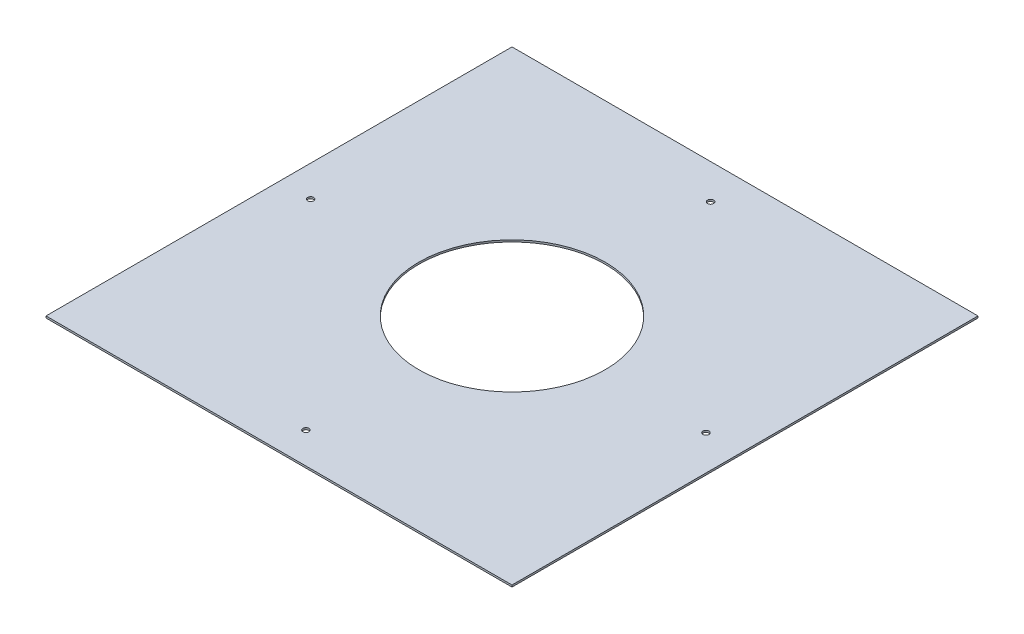
from build123d import *

# Parameters (mm, degrees)
SKETCH1_W           = 500
SKETCH1_H           = 500
SKETCH1_R           = 100
BOSS_EXTRUDE1_DEPTH = 2
SKETCH_1_R          = 3.25
CUT_EXTRUDE_1_DEPTH = 10


with BuildPart() as part:
    # Sketch1 → Boss-Extrude1 (new body)
    with BuildSketch(Plane(origin=(0, 0, 0), x_dir=(1, 0, 0), z_dir=(0, 1, 0))):
        with Locations((250, 250)):
            Rectangle(SKETCH1_W, SKETCH1_H)
        with Locations(Location((250, 250, 0), (0, 0, 270))):
            Circle(SKETCH1_R, mode=Mode.SUBTRACT)
    extrude(amount=BOSS_EXTRUDE1_DEPTH)

    # 草图1 → 切除-拉伸1 (cut)
    with BuildSketch(Plane(origin=(0, 2, 0), x_dir=(1, 0, 0), z_dir=(0, 1, 0))):
        with Locations(Location((245.5, 33.4, 0), (0, 0, 270))):
            Circle(SKETCH_1_R)
        with Locations(Location((33.4, 250.5, 0), (0, 0, 270))):
            Circle(SKETCH_1_R)
        with Locations(Location((462.6, 245.5, 0), (0, 0, 270))):
            Circle(SKETCH_1_R)
        with Locations(Location((250.5, 462.6, 0), (0, 0, 270))):
            Circle(SKETCH_1_R)
    extrude(amount=-CUT_EXTRUDE_1_DEPTH, mode=Mode.SUBTRACT)


solid = part.part
